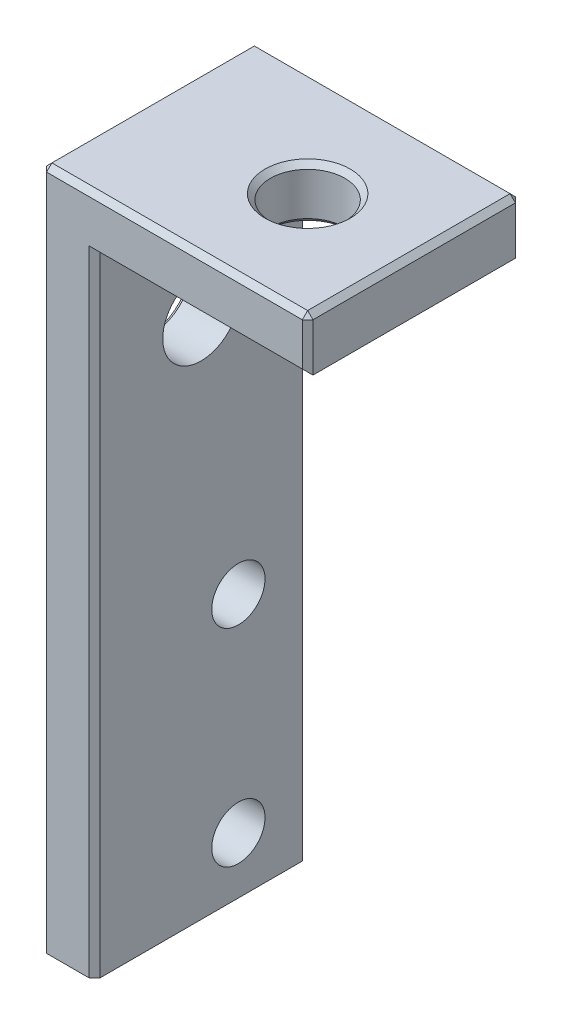
from build123d import *

# Parameters (mm, degrees)
BOSS_EXTRUDE1_DEPTH = 10
SKETCH2_R           = 1.75
CUT_EXTRUDE1_DEPTH  = 10
SKETCH3_R           = 1.25
SKETCH3_R_2         = 1.8
CUT_EXTRUDE2_DEPTH  = 40.143965052
CHAMFER1_SIZE       = 0.25
SKETCH4_W           = 13.022509218
SKETCH4_H           = 4.5
CUT_EXTRUDE3_DEPTH  = 40.143965052


with BuildPart() as part:
    # Sketch1 → Boss-Extrude1 (new body)
    with BuildSketch(Plane.XY):
        Polygon((0, 0), (0, 36.5), (12.5, 36.5), (12.5, 34), (2.5, 34), (2.5, 0), align=None)
    extrude(amount=BOSS_EXTRUDE1_DEPTH)

    # Sketch2 → Cut-Extrude1 (cut)
    with BuildSketch(Plane.XZ.offset(-34)):
        with Locations((7.5, 5)):
            Circle(SKETCH2_R)
    extrude(amount=-CUT_EXTRUDE1_DEPTH, mode=Mode.SUBTRACT)

    # Sketch3 → Cut-Extrude2 (cut, through all)
    with BuildSketch(Plane(origin=(2.5, 0, 0), x_dir=(0, 0, -1), z_dir=(1, 0, 0))):
        with Locations(Location((-3.25, 7.15, 0), (0, 0, 90))):
            Circle(SKETCH3_R)
        with Locations(Location((-3.25, 16.85, 0), (0, 0, 270))):
            Circle(SKETCH3_R)
        with Locations(Location((-5, 29, 0), (0, 0, 90))):
            Circle(SKETCH3_R_2)
    extrude(amount=-CUT_EXTRUDE2_DEPTH, mode=Mode.SUBTRACT)

    # Chamfer1
    chamfer1_edges = [part.edges().sort_by_distance(p)[0] for p in [
        (0, 0, 5),
        (0, 36.5, 5),
        (12.5, 36.5, 5),
        (2.5, 0, 5),
        (7.5, 34, 10),
        (12.5, 35.25, 10),
        (5.75, 36.5, 5),
        (6.25, 36.5, 10),
        (5.75, 34, 5),
        (0, 18.25, 10),
        (0, 5.9, 3.25),
        (0, 18.1, 3.25),
        (0, 27.2, 5),
        (1.25, 0, 10),
        (0, 18.25, 0),
        (6.25, 36.5, 0),
        (12.5, 35.25, 0),
        (7.5, 34, 0),
        (2.5, 17, 0),
        (1.25, 0, 0),
        (2.5, 17, 10),
    ]]
    chamfer(chamfer1_edges, length=CHAMFER1_SIZE)

    # Sketch4 → Cut-Extrude3 (cut, through all)
    with BuildSketch(Plane(origin=(2.5, 0, 0), x_dir=(0, 0, -1), z_dir=(1, 0, 0))):
        with Locations((-6.511254609, 2.25)):
            Rectangle(SKETCH4_W, SKETCH4_H)
    extrude(amount=-CUT_EXTRUDE3_DEPTH, mode=Mode.SUBTRACT)


solid = part.part
